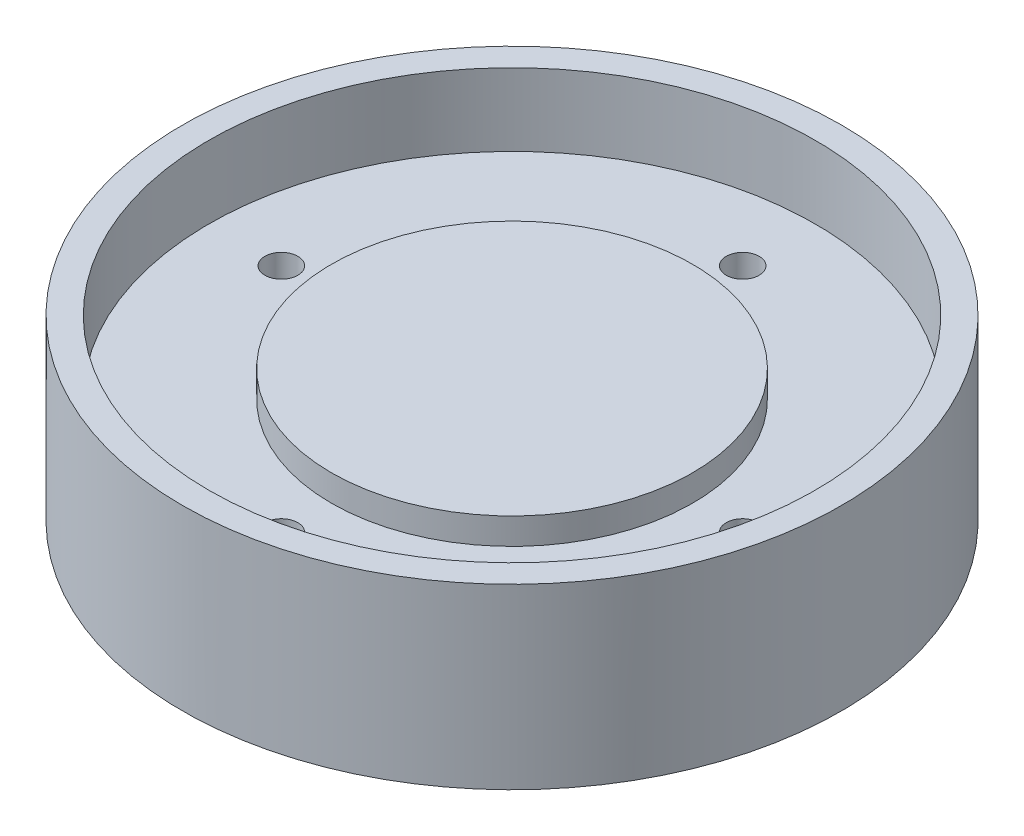
from build123d import *

# Parameters (mm, degrees)
SKETCH1_R           = 50
BOSS_EXTRUDE2_DEPTH = 15
SHELL1_T            = -4
SKETCH3_R           = 27.405
BOSS_EXTRUDE3_DEPTH = 4
SKETCH7_R           = 2.5
CUT_EXTRUDE1_DEPTH  = 12
BOSS_EXTRUDE5_START = 12
SKETCH8_R           = 50
SKETCH8_R_2         = 48
BOSS_EXTRUDE5_DEPTH = 12


with BuildPart() as part:
    # Sketch1 → Boss-Extrude2 (new body)
    with BuildSketch(Plane(origin=(0, 0, 0), x_dir=(1, 0, 0), z_dir=(0, 1, 0))):
        with Locations(Location((0, 0, 0), (0, 0, 270))):
            Circle(SKETCH1_R)
    extrude(amount=BOSS_EXTRUDE2_DEPTH)

    # Shell1
    shell1_openings = [part.faces().sort_by_distance(p)[0] for p in [
        (0, 15, 0),
    ]]
    offset(amount=SHELL1_T, openings=shell1_openings, kind=Kind.INTERSECTION)

    # Sketch3 → Boss-Extrude3 (add)
    with BuildSketch(Plane(origin=(0, 4, 0), x_dir=(1, 0, 0), z_dir=(0, 1, 0))):
        with Locations(Location((0, 0, 0), (0, 0, 270))):
            Circle(SKETCH3_R)
    extrude(amount=BOSS_EXTRUDE3_DEPTH)

    # Sketch7 → Cut-Extrude1 (cut)
    with BuildSketch(Plane(origin=(0, 8, 0), x_dir=(1, 0, 0), z_dir=(0, 1, 0))):
        with Locations(Location((35, 0, 0), (0, 0, 270))):
            Circle(SKETCH7_R)
        with Locations(Location((0, 35, 0), (0, 0, 270))):
            Circle(SKETCH7_R)
        with Locations(Location((-35, 0, 0), (0, 0, 270))):
            Circle(SKETCH7_R)
        with Locations(Location((0, -35, 0), (0, 0, 270))):
            Circle(SKETCH7_R)
    extrude(amount=-CUT_EXTRUDE1_DEPTH, mode=Mode.SUBTRACT)

    # Sketch8 → Boss-Extrude5 (add)
    with BuildSketch(Plane(origin=(0, 0, 0), x_dir=(-1, 0, 0), z_dir=(0, -1, 0)).offset(BOSS_EXTRUDE5_START)):
        with Locations(Location((0, 0, 0), (0, 0, 90))):
            Circle(SKETCH8_R)
        with Locations(Location((0, 0, 0), (0, 0, 90))):
            Circle(SKETCH8_R_2, mode=Mode.SUBTRACT)
    extrude(amount=-BOSS_EXTRUDE5_DEPTH)


solid = part.part
